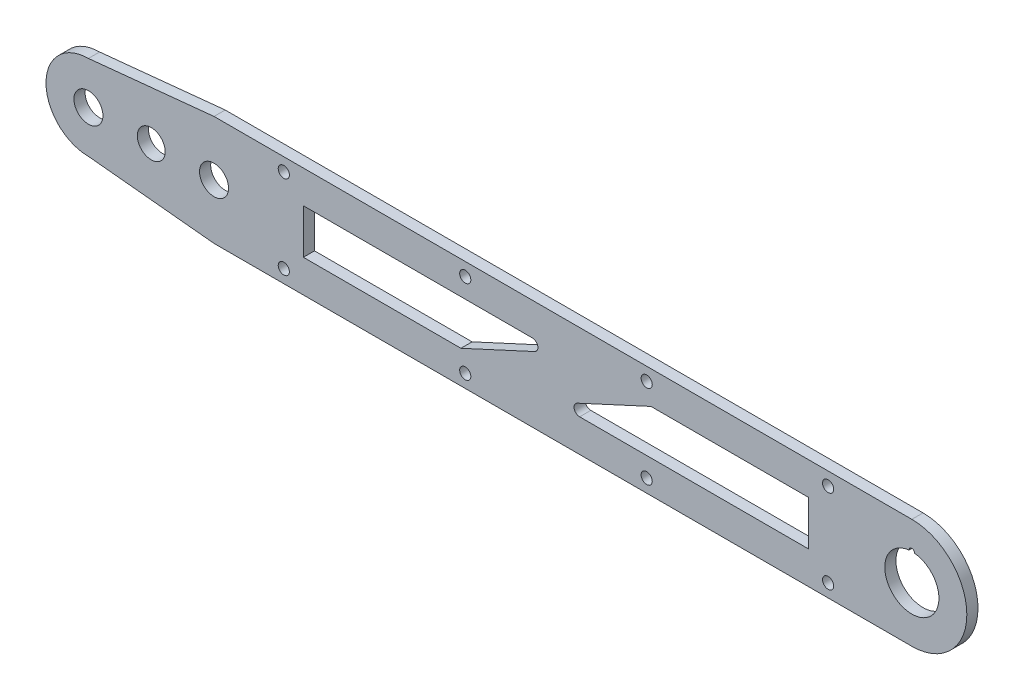
from build123d import *

# Parameters (mm, degrees)
SKETCH_1_R          = 5.2
SKETCH_1_R_2        = 9.7
EXTRUDE_1_DEPTH     = 4
SKETCH_2_R          = 2
CUT_EXTRUDE_1_DEPTH = 10
SKETCH_3_R          = 5
CUT_EXTRUDE_2_DEPTH = 10
SKETCH_4_R          = 1
CUT_EXTRUDE_3_DEPTH = 10


with BuildPart() as part:
    # 草图1 → 凸台-拉伸1 (new body)
    with BuildSketch(Plane.XY):
        with BuildLine():
            Line((250, 19.7), (0, 19.7))
            Line((0, 19.7), (-45, 15.2))
            ThreePointArc((-45, 15.2), (-60.2, 0), (-45, -15.2))
            Line((-45, -15.2), (0, -19.7))
            Line((0, -19.7), (250, -19.7))
            ThreePointArc((250, -19.7), (269.7, 0), (250, 19.7))
        make_face()
        Circle(SKETCH_1_R, mode=Mode.SUBTRACT)
        with Locations((250, 0)):
            Circle(SKETCH_1_R_2, mode=Mode.SUBTRACT)
        with Locations((-45, 0)):
            Circle(SKETCH_1_R, mode=Mode.SUBTRACT)
    extrude(amount=EXTRUDE_1_DEPTH)

    # 草图2 → 切除-拉伸1 (cut)
    with BuildSketch(Plane.XY.offset(4)):
        with Locations((25, 15)):
            Circle(SKETCH_2_R)
        with Locations((90, 15)):
            Circle(SKETCH_2_R)
        with Locations((155, 15)):
            Circle(SKETCH_2_R)
        with Locations((220, 15)):
            Circle(SKETCH_2_R)
        with Locations((90, -15)):
            Circle(SKETCH_2_R)
        with Locations((155, -15)):
            Circle(SKETCH_2_R)
        with Locations((220, -15)):
            Circle(SKETCH_2_R)
        with Locations((25, -15)):
            Circle(SKETCH_2_R)
    extrude(amount=-CUT_EXTRUDE_1_DEPTH, mode=Mode.SUBTRACT)

    # 草图3 → 切除-拉伸2 (cut)
    with BuildSketch(Plane.XY.offset(4)):
        with Locations((-22.5, 0)):
            Circle(SKETCH_3_R)
        with BuildLine():
            Line((32, 8), (32, -8))
            Line((32, -8), (88.462542093, -8))
            Line((88.462542093, -8), (114.86138476, 4.184081231))
            ThreePointArc((114.86138476, 4.184081231), (115.976706085, 6.429046887), (114.023268405, 8))
            Line((114.023268405, 8), (32, 8))
        make_face()
        with BuildLine():
            Line((156.537457907, 8), (213, 8))
            Line((213, 8), (213, -8))
            Line((213, -8), (130.976731595, -8))
            ThreePointArc((130.976731595, -8), (129.023293915, -6.429046887), (130.13861524, -4.184081231))
            Line((130.13861524, -4.184081231), (156.537457907, 8))
        make_face()
    extrude(amount=-CUT_EXTRUDE_2_DEPTH, mode=Mode.SUBTRACT)

    # 草图4 → 切除-拉伸3 (cut)
    with BuildSketch(Plane.XY.offset(4)):
        with Locations((250, 9.7)):
            Circle(SKETCH_4_R)
    extrude(amount=-CUT_EXTRUDE_3_DEPTH, mode=Mode.SUBTRACT)


solid = part.part
